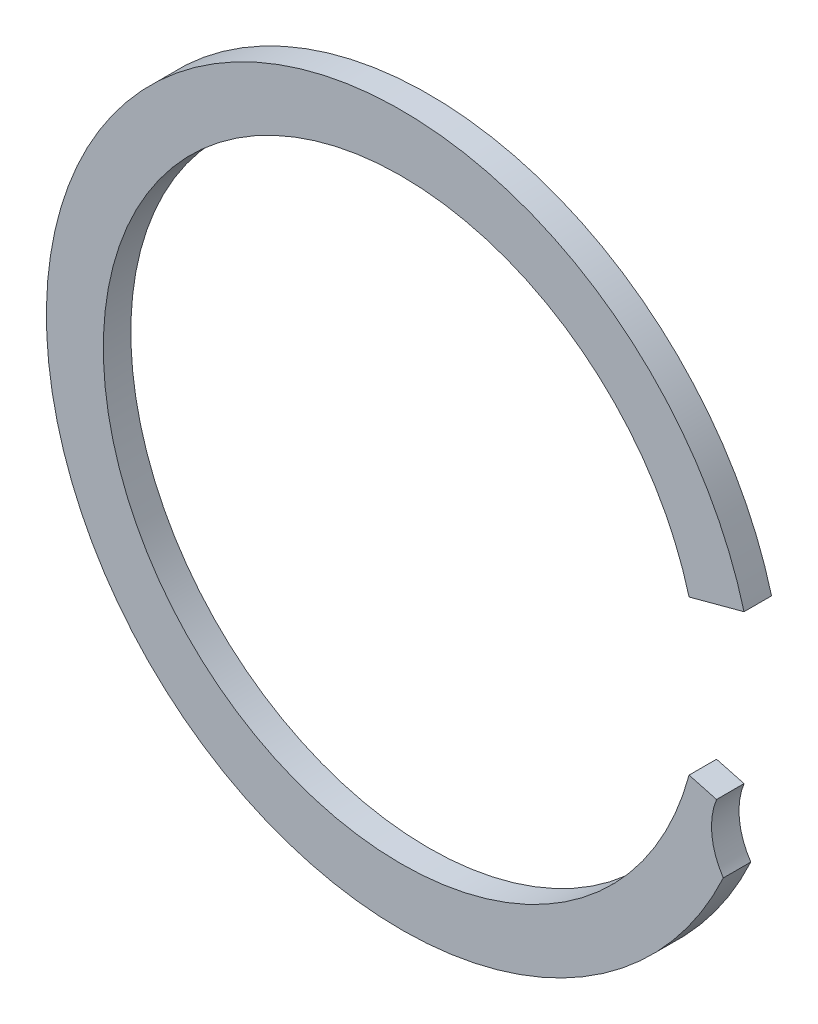
from build123d import *

# Parameters (mm, degrees)
BOSS_EXTRUDE1_DEPTH = 1.15


with BuildPart() as part:
    # Sketch1 → Boss-Extrude1 (new body)
    with BuildSketch(Plane(origin=(0, 0, 0), x_dir=(-1, 0, 0), z_dir=(0, 0, -1))):
        with BuildLine():
            Line((-14.334339262, 3.840874629), (-12.035435796, 3.224885302))
            ThreePointArc((-12.035435796, 3.224885302), (12.46, 0), (-12.035435796, -3.224885302))
            Line((-12.035435796, -3.224885302), (-13.184887529, -3.532879966))
            ThreePointArc((-13.184887529, -3.532879966), (-12.98832562, -4.918513333), (-13.467338447, -6.233489806))
            ThreePointArc((-13.467338447, -6.233489806), (14.785348341, 1.272428564), (-14.334339262, 3.840874629))
        make_face()
    extrude(amount=-BOSS_EXTRUDE1_DEPTH)


solid = part.part
